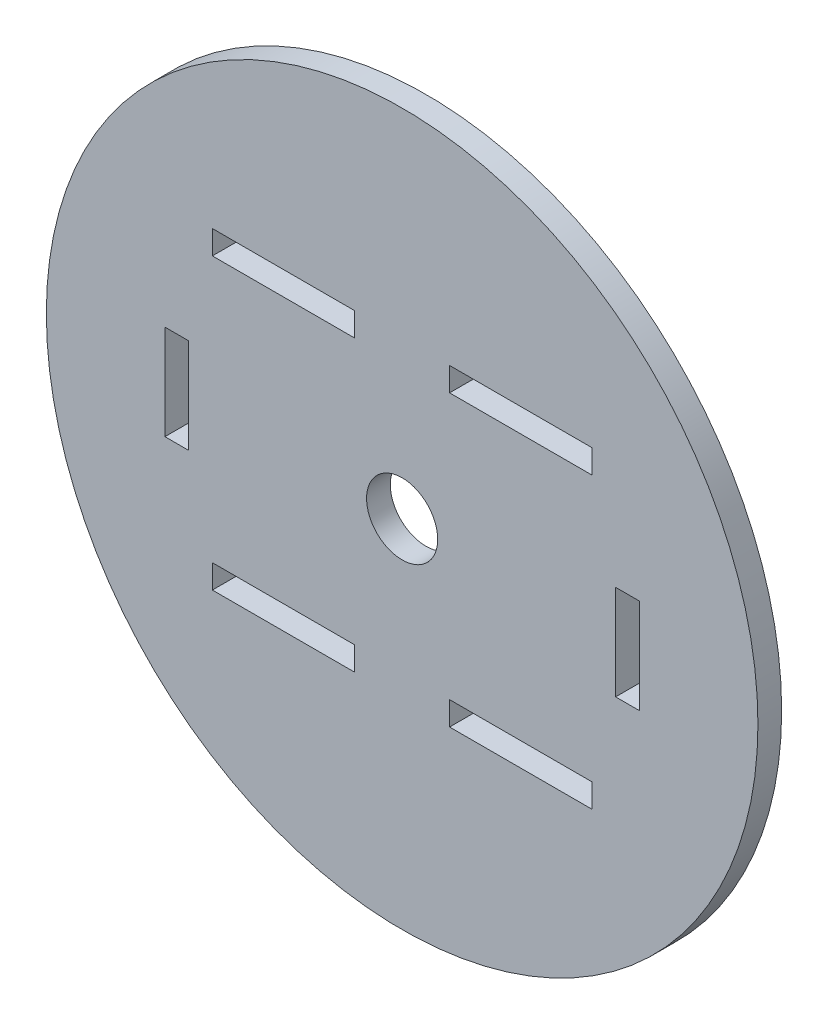
from build123d import *

# Parameters (mm, degrees)
SKETCH1_R           = 47.625
SKETCH1_R_2         = 4.7625
BOSS_EXTRUDE1_DEPTH = 3.175
SKETCH3_W           = 19.05
SKETCH3_H           = 3.175
CUT_EXTRUDE2_DEPTH  = 3.175


with BuildPart() as part:
    # Sketch1 → Boss-Extrude1 (new body)
    with BuildSketch(Plane.XY):
        Circle(SKETCH1_R)
        Circle(SKETCH1_R_2, mode=Mode.SUBTRACT)
    extrude(amount=BOSS_EXTRUDE1_DEPTH)

    # Sketch3 → Cut-Extrude2 (cut)
    with BuildSketch(Plane.XY):
        Polygon((-28.575, 0), (-28.575, -6.35), (-31.75, -6.35), (-31.75, 6.35), (-28.575, 6.35), align=None)
        Polygon((31.75, 0), (31.75, 6.35), (28.575, 6.35), (28.575, -6.35), (31.75, -6.35), align=None)
        with Locations((15.875, 19.3675)):
            Rectangle(SKETCH3_W, SKETCH3_H)
        with Locations((-15.875, 19.3675)):
            Rectangle(SKETCH3_W, SKETCH3_H)
        with Locations((-15.875, -19.3675)):
            Rectangle(SKETCH3_W, SKETCH3_H)
        with Locations((15.875, -19.3675)):
            Rectangle(SKETCH3_W, SKETCH3_H)
    extrude(amount=CUT_EXTRUDE2_DEPTH, mode=Mode.SUBTRACT)


solid = part.part
